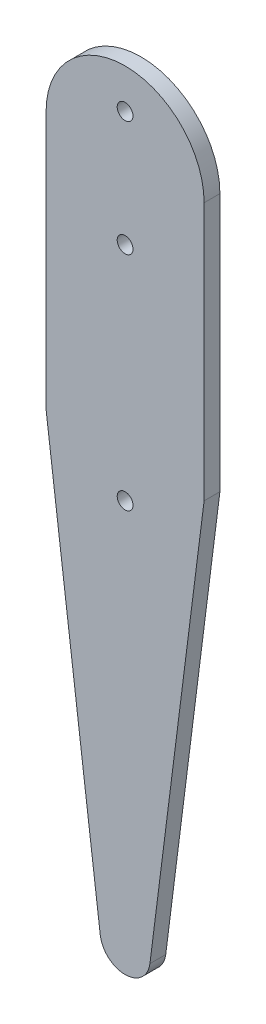
from build123d import *

# Parameters (mm, degrees)
SKETCH1_R           = 1.5
BOSS_EXTRUDE1_DEPTH = 3


with BuildPart() as part:
    # Sketch1 → Boss-Extrude1 (new body)
    with BuildSketch(Plane.XY):
        with BuildLine():
            Line((-5, 44.75), (-5, -4.25))
            Line((-5, -4.25), (5.287636044, -85.486762889))
            ThreePointArc((5.287636044, -85.486762889), (10, -89.64), (14.712363956, -85.486762889))
            Line((14.712363956, -85.486762889), (25, -4.25))
            Line((25, -4.25), (25, 44.75))
            ThreePointArc((25, 44.75), (10, 59.75), (-5, 44.75))
        make_face()
        with Locations((10, 30.36)):
            Circle(SKETCH1_R, mode=Mode.SUBTRACT)
        with Locations((10, 52.25)):
            Circle(SKETCH1_R, mode=Mode.SUBTRACT)
        with Locations((10, -11.75)):
            Circle(SKETCH1_R, mode=Mode.SUBTRACT)
    extrude(amount=BOSS_EXTRUDE1_DEPTH)


solid = part.part
